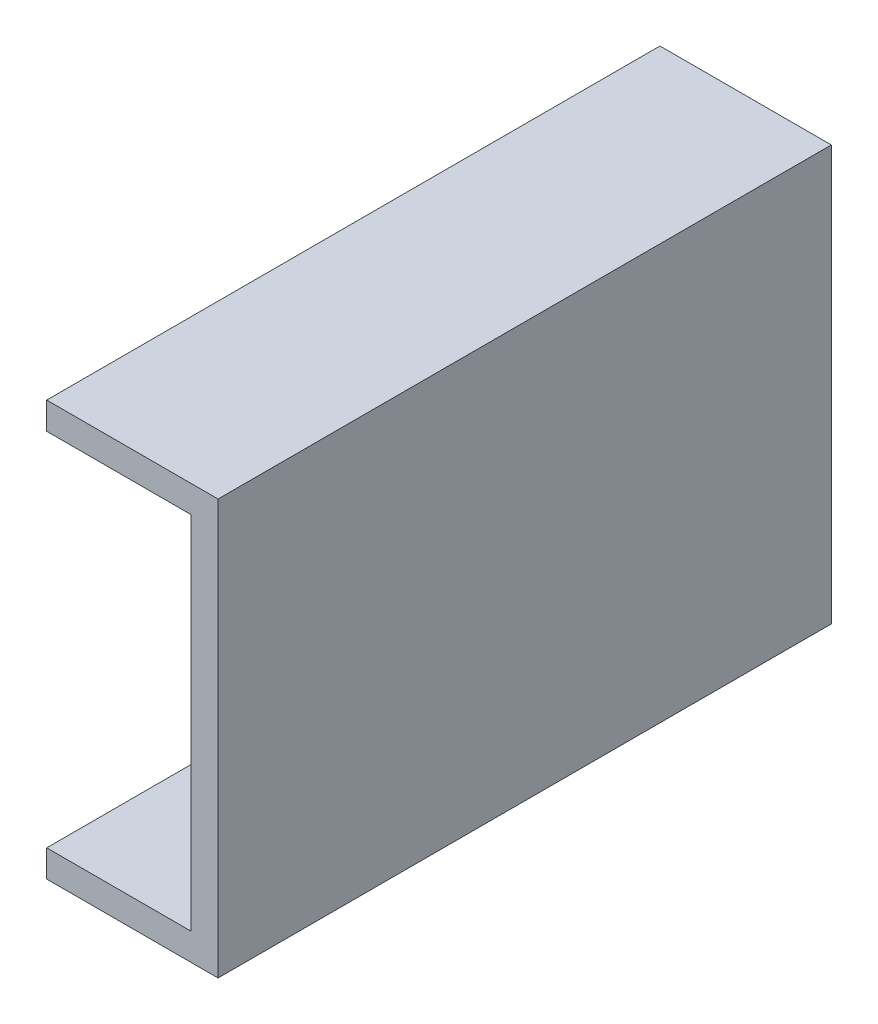
from build123d import *

# Parameters (mm, degrees)
EXTRUDE_1_DEPTH     = 68
SKETCH_2_R          = 2.5
CUT_EXTRUDE_1_DEPTH = 10


with BuildPart() as part:
    # 草图1 → 凸台-拉伸1 (new body)
    with BuildSketch(Plane.XY):
        Polygon((0, 0), (16, 0), (16, -40), (0, -40), (0, -43), (19, -43), (19, 3), (0, 3), align=None)
    extrude(amount=EXTRUDE_1_DEPTH)

    # 草图2 → 切除-拉伸1 (cut)
    with BuildSketch(Plane.XZ.offset(43)):
        with Locations(Location((11, 7.250946933, 0), (0, 0, 270))):
            Circle(SKETCH_2_R)
        with Locations(Location((11, 57.250946933, 0), (0, 0, 270))):
            Circle(SKETCH_2_R)
    extrude(amount=-CUT_EXTRUDE_1_DEPTH, mode=Mode.SUBTRACT)


solid = part.part
